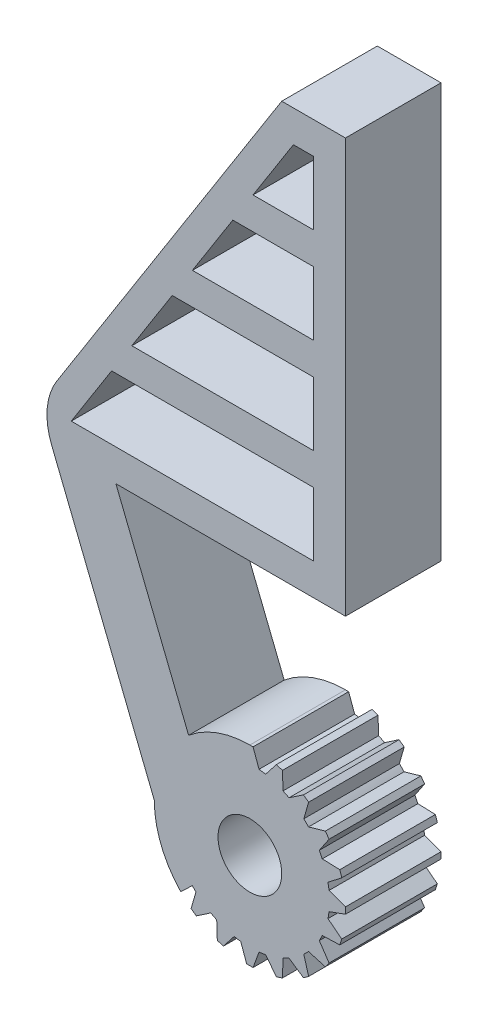
from build123d import *

# Parameters (mm, degrees)
SKETCH1_R           = 5
BOSS_EXTRUDE1_DEPTH = 15
CUT_EXTRUDE1_START  = -15
CUT_EXTRUDE1_DEPTH  = 15
BOSS_EXTRUDE2_START = -15
BOSS_EXTRUDE2_DEPTH = 15
FILLET1_R           = 10


with BuildPart() as part:
    # Sketch1 → Boss-Extrude1 (new body)
    with BuildSketch(Plane.XY):
        with BuildLine():
            Line((0, 0), (-10, 0))
            Line((-10, 0), (-48.033043506, -60))
            Line((-48.033043506, -60), (-30, -105))
            ThreePointArc((-30, -105), (-1.41305071, -111.355691072), (-24.614025467, -93.486073028))
            Line((-24.614025467, -93.486073028), (-36.029372005, -65))
            Line((-36.029372005, -65), (0, -65))
            Line((0, -65), (0, 0))
        make_face()
        Polygon((-5, -50), (-5, -60), (-43.033043506, -60), (-36.694202922, -50), align=None, mode=Mode.SUBTRACT)
        Polygon((-27.185942045, -35), (-5, -35), (-5, -45), (-33.52478263, -45), align=None, mode=Mode.SUBTRACT)
        Polygon((-17.677681169, -20), (-5, -20), (-5, -30), (-24.016521753, -30), align=None, mode=Mode.SUBTRACT)
        Polygon((-14.508260877, -15), (-8.169420292, -5), (-5, -5), (-5, -15), align=None, mode=Mode.SUBTRACT)
        with Locations((-15, -105)):
            Circle(SKETCH1_R, mode=Mode.SUBTRACT)
    extrude(amount=BOSS_EXTRUDE1_DEPTH)

    # Sketch2 → Cut-Extrude1 (cut)
    with BuildSketch(Plane.XY.offset(15).offset(CUT_EXTRUDE1_START)):
        with BuildLine():
            Line((-15, -90), (-15, -92.5))
            ThreePointArc((-15, -92.5), (-3.506810704, -109.914936399), (-24.038127106, -113.634944031))
            Line((-24.038127106, -113.634944031), (-25.845752528, -115.361932837))
            ThreePointArc((-25.845752528, -115.361932837), (-1.208172845, -110.897923679), (-15, -90))
        make_face()
    extrude(amount=CUT_EXTRUDE1_DEPTH, mode=Mode.SUBTRACT)

    # Sketch3 → Boss-Extrude2 (add)
    with BuildSketch(Plane.XY.offset(15).offset(BOSS_EXTRUDE2_START)):
        with BuildLine():
            Line((-14.5, -90), (-15, -90))
            Line((-15, -90), (-15, -92.5))
            ThreePointArc((-15, -92.5), (-14.279138, -92.520802992), (-13.560675373, -92.583142724))
            Line((-13.560675373, -92.583142724), (-14.5, -90))
        make_face()
        with BuildLine():
            Line((-10.840273343, -90.579643758), (-12.53185915, -92.746091205))
            ThreePointArc((-12.53185915, -92.746091205), (-11.13728757, -93.111793546), (-9.79410102, -93.635642746))
            Line((-9.79410102, -93.635642746), (-9.889216826, -90.888660753))
            Line((-9.889216826, -90.888660753), (-10.840273343, -90.579643758))
        make_face()
        with BuildLine():
            Line((-6.587729713, -92.570852458), (-8.865992497, -94.108537658))
            ThreePointArc((-8.865992497, -94.108537658), (-7.652684346, -94.88728757), (-6.53711633, -95.800565236))
            Line((-6.53711633, -95.800565236), (-5.778712718, -93.158637711))
            Line((-5.778712718, -93.158637711), (-6.587729713, -92.570852458))
        make_face()
        with BuildLine():
            Line((-3.158637711, -95.778712718), (-5.800565236, -96.53711633))
            ThreePointArc((-5.800565236, -96.53711633), (-4.88728757, -97.652684346), (-4.108537658, -98.865992497))
            Line((-4.108537658, -98.865992497), (-2.570852458, -96.587729713))
            Line((-2.570852458, -96.587729713), (-3.158637711, -95.778712718))
        make_face()
        with BuildLine():
            Line((-0.888660753, -99.889216826), (-3.635642746, -99.79410102))
            ThreePointArc((-3.635642746, -99.79410102), (-3.111793546, -101.13728757), (-2.746091205, -102.53185915))
            Line((-2.746091205, -102.53185915), (-0.579643758, -100.840273343))
            Line((-0.579643758, -100.840273343), (-0.888660753, -99.889216826))
        make_face()
        with BuildLine():
            Line((0, -104.5), (-2.583142724, -103.560675373))
            ThreePointArc((-2.583142724, -103.560675373), (-2.5, -105), (-2.583142724, -106.439324627))
            Line((-2.583142724, -106.439324627), (0, -105.5))
            Line((0, -105.5), (0, -104.5))
        make_face()
        with BuildLine():
            Line((-0.579643758, -109.159726657), (-2.746091205, -107.46814085))
            ThreePointArc((-2.746091205, -107.46814085), (-3.111793546, -108.86271243), (-3.635642746, -110.20589898))
            Line((-3.635642746, -110.20589898), (-0.888660753, -110.110783174))
            Line((-0.888660753, -110.110783174), (-0.579643758, -109.159726657))
        make_face()
        with BuildLine():
            ThreePointArc((-21.134007503, -115.891462342), (-22.347315654, -115.11271243), (-23.46288367, -114.199434764))
            Line((-23.46288367, -114.199434764), (-24.221287282, -116.841362289))
            Line((-24.221287282, -116.841362289), (-23.412270287, -117.429147542))
            Line((-23.412270287, -117.429147542), (-21.134007503, -115.891462342))
        make_face()
        with BuildLine():
            Line((-2.570852458, -113.412270287), (-4.108537658, -111.134007503))
            ThreePointArc((-4.108537658, -111.134007503), (-4.88728757, -112.347315654), (-5.800565236, -113.46288367))
            Line((-5.800565236, -113.46288367), (-3.158637711, -114.221287282))
            Line((-3.158637711, -114.221287282), (-2.570852458, -113.412270287))
        make_face()
        with BuildLine():
            ThreePointArc((-17.46814085, -117.253908795), (-18.86271243, -116.888206454), (-20.20589898, -116.364357254))
            Line((-20.20589898, -116.364357254), (-20.110783174, -119.111339247))
            Line((-20.110783174, -119.111339247), (-19.159726657, -119.420356242))
            Line((-19.159726657, -119.420356242), (-17.46814085, -117.253908795))
        make_face()
        with BuildLine():
            Line((-5.778712718, -116.841362289), (-6.53711633, -114.199434764))
            ThreePointArc((-6.53711633, -114.199434764), (-7.652684346, -115.11271243), (-8.865992497, -115.891462342))
            Line((-8.865992497, -115.891462342), (-6.587729713, -117.429147542))
            Line((-6.587729713, -117.429147542), (-5.778712718, -116.841362289))
        make_face()
        with BuildLine():
            ThreePointArc((-13.560675373, -117.416857276), (-15, -117.5), (-16.439324627, -117.416857276))
            Line((-16.439324627, -117.416857276), (-15.5, -120))
            Line((-15.5, -120), (-14.5, -120))
            Line((-14.5, -120), (-13.560675373, -117.416857276))
        make_face()
        with BuildLine():
            Line((-9.889216826, -119.111339247), (-9.79410102, -116.364357254))
            ThreePointArc((-9.79410102, -116.364357254), (-11.13728757, -116.888206454), (-12.53185915, -117.253908795))
            Line((-12.53185915, -117.253908795), (-10.840273343, -119.420356242))
            Line((-10.840273343, -119.420356242), (-9.889216826, -119.111339247))
        make_face()
    extrude(amount=BOSS_EXTRUDE2_DEPTH)

    # Fillet1
    fillet1_edges = [part.edges().sort_by_distance(p)[0] for p in [
        (-48.033043506, -60, 7.5),
    ]]
    fillet(fillet1_edges, radius=FILLET1_R)


solid = part.part
